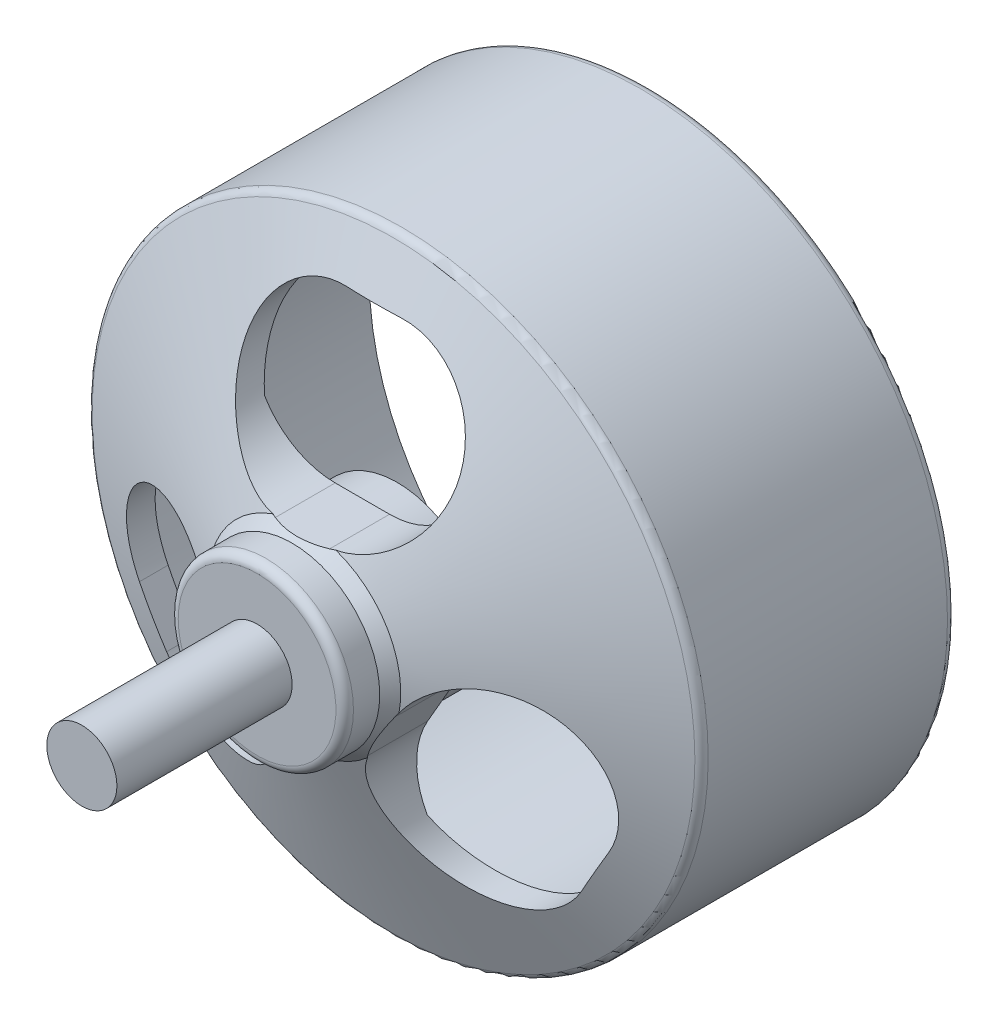
from build123d import *

# Parameters (mm, degrees)
CUT_EXTRUDE_1_DEPTH      = 10
PATTERN_CIRCULAR_1_COUNT = 3
FILLET_1_R               = 0.5


with BuildPart() as part:
    # Эскиз1 → Повернуть1 (revolve)
    with BuildSketch(Plane(origin=(0, 0, 0), x_dir=(0, 0, -1), z_dir=(1, 0, 0)), mode=Mode.PRIVATE) as revolve_1_sk:
        Polygon((-9, 0), (-9, 2), (1, 2), (1, 5), (3, 5), (3.7, 5.5), (8.916460066, 17.5), (23.4, 17.5), (23.4, 16), (9.9, 16), (7.009211714, 9.35), (7.009211714, 5), (9, 5), (9, 0), align=None)
    revolve(revolve_1_sk.sketch.rotate(Axis((0, 0, -9), (0, 0, -1)), 90), axis=Axis((0, 0, -9), (0, 0, -1)))

    # Эскиз2 → Вырез-Вытянуть1 (cut)
    with BuildSketch(Plane.XY.offset(-1)):
        with BuildLine():
            Line((1.55, 14.5641447), (-1.55, 14.5641447))
            ThreePointArc((-1.55, 14.5641447), (-6.235, 9.8791447), (-1.55, 5.1941447))
            Line((-1.55, 5.1941447), (1.55, 5.1941447))
            ThreePointArc((1.55, 5.1941447), (6.235, 9.8791447), (1.55, 14.5641447))
        make_face()
    cut_extrude_1 = extrude(amount=-CUT_EXTRUDE_1_DEPTH, mode=Mode.SUBTRACT)

    # Круговой массив1: Вырез-Вытянуть1 ×3 about axis
    pattern_circular_1_axis = Axis((0, 0, 0), (0, 0, 1))
    for i in range(1, PATTERN_CIRCULAR_1_COUNT):
        add(cut_extrude_1.rotate(pattern_circular_1_axis, i * 360 / PATTERN_CIRCULAR_1_COUNT), mode=Mode.SUBTRACT)

    # Скругление1
    fillet_1_edges = [part.edges().sort_by_distance(p)[0] for p in [
        (-17.5, 0, -23.4),
        (-17.5, 0, -8.916460066),
        (-5, 0, -1),
    ]]
    fillet(fillet_1_edges, radius=FILLET_1_R)


solid = part.part
